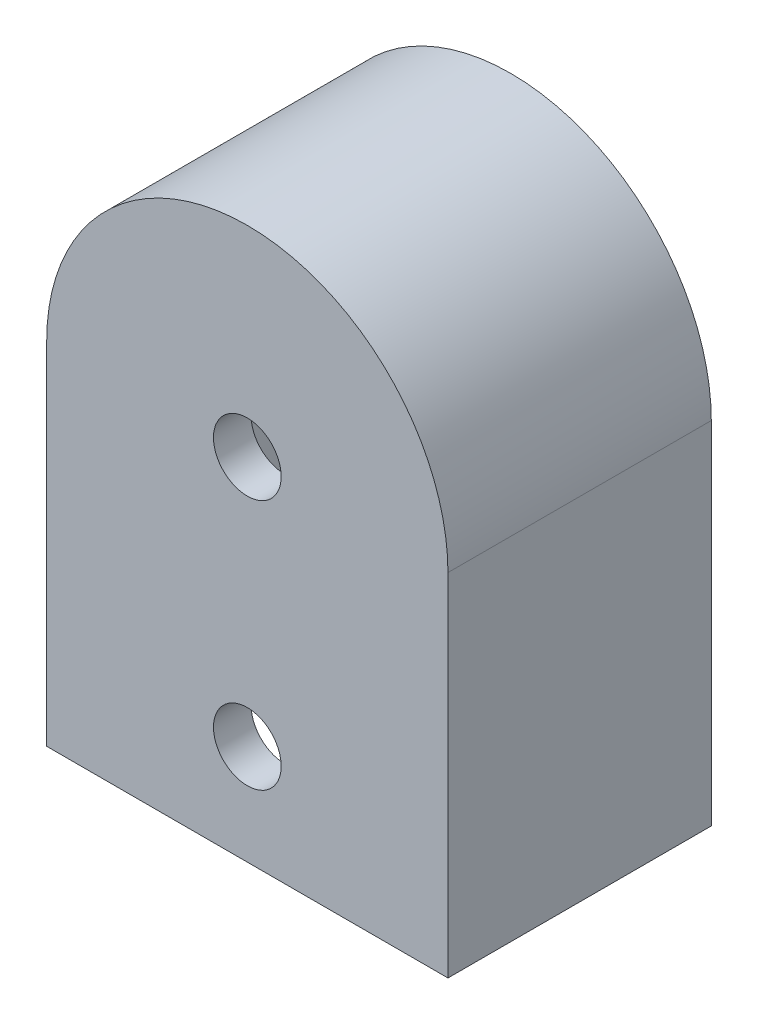
from build123d import *

# Parameters (mm, degrees)
BOSS_EXTRUDE1_DEPTH      = 26.67
SKETCH3_W                = 40.639965772
SKETCH3_H                = 26.67
BOSS_EXTRUDE2_DEPTH      = 35.56
CUT_EXTRUDE3_START       = 3.81
CUT_EXTRUDE3_DEPTH       = 19.05
SKETCH9_W                = 30.48
SKETCH9_H                = 19.05
CUT_EXTRUDE4_DEPTH       = 35.533627808
CUT_EXTRUDE8_REACH       = 50.855
SKETCH10_R               = 3.429
SKETCH11_R               = 5.715
CUT_EXTRUDE9_DEPTH       = 3.048
SKETCH12_R               = 5.715
CUT_EXTRUDE10_DEPTH      = 3.048
SKETCH13_R               = 5.715
CUT_EXTRUDE11_DEPTH      = 3.048
CUT_EXTRUDE12_DEPTH      = 49.855187132
CUT_EXTRUDE12_DEPTH_BACK = 49.855187132
SKETCH16_R               = 3.429


with BuildPart() as part:
    # Sketch2 → Boss-Extrude1 (new body)
    with BuildSketch(Plane.XY):
        with BuildLine():
            Line((-20.319982886, 0.026372192), (20.319982886, 0.026372192))
            ThreePointArc((20.319982886, 0.026372192), (0, 20.32), (-20.319982886, 0.026372192))
        make_face()
    extrude(amount=BOSS_EXTRUDE1_DEPTH)

    # Sketch3 → Boss-Extrude2 (add)
    with BuildSketch(Plane(origin=(0, 0.026372192, 0), x_dir=(-1, 0, 0), z_dir=(0, -1, 0))):
        with Locations((0, -13.335)):
            Rectangle(SKETCH3_W, SKETCH3_H)
    extrude(amount=BOSS_EXTRUDE2_DEPTH)

    # Sketch8 → Cut-Extrude3 (cut)
    with BuildSketch(Plane.XY.offset(CUT_EXTRUDE3_START)):
        with BuildLine():
            Line((15.24, 0), (-15.24, 0))
            ThreePointArc((-15.24, 0), (0, 15.24), (15.24, 0))
        make_face()
    extrude(amount=CUT_EXTRUDE3_DEPTH, mode=Mode.SUBTRACT)

    # Sketch9 → Cut-Extrude4 (cut)
    with BuildSketch(Plane(origin=(0, 0, 0), x_dir=(1, 0, 0), z_dir=(0, 1, 0))):
        with Locations((0, -13.335)):
            Rectangle(SKETCH9_W, SKETCH9_H)
    extrude(amount=-CUT_EXTRUDE4_DEPTH, mode=Mode.SUBTRACT)

    # Cut-Extrude8: up to this face of the body (flat: up to its plane)
    cut_extrude8_end = Plane(part.part.faces().sort_by_distance((0, -9.587434333, 26.67))[0])
    # Sketch10 → Cut-Extrude8 (cut, up to the picked face)
    with BuildSketch(Plane.XY, mode=Mode.PRIVATE) as cut_extrude8_sk1:
        with Locations(Location((0, 0, 0), (0, 0, 180))):
            Circle(SKETCH10_R)
    cut_extrude8_tool1 = split(extrude(cut_extrude8_sk1.sketch, amount=CUT_EXTRUDE8_REACH, mode=Mode.PRIVATE), bisect_by=cut_extrude8_end, keep=Keep.BOTH, mode=Mode.PRIVATE)
    add(cut_extrude8_tool1.solids().sort_by(Axis((0, 0, 0), (0, 0, 1)))[0], mode=Mode.SUBTRACT)

    # Sketch11 → Cut-Extrude9 (cut)
    with BuildSketch(Plane.XY):
        with Locations(Location((12.7, 0, 0), (0, 0, 180))):
            Circle(SKETCH11_R)
    extrude(amount=CUT_EXTRUDE9_DEPTH, mode=Mode.SUBTRACT)

    # Sketch12 → Cut-Extrude10 (cut)
    with BuildSketch(Plane.XY):
        with Locations(Location((12.7, -25.4, 0), (0, 0, 180))):
            Circle(SKETCH12_R)
    extrude(amount=CUT_EXTRUDE10_DEPTH, mode=Mode.SUBTRACT)

    # Sketch13 → Cut-Extrude11 (cut)
    with BuildSketch(Plane(origin=(0, 0, 0), x_dir=(-1, 0, 0), z_dir=(0, 0, -1))):
        with Locations((12.7, 0)):
            Circle(SKETCH13_R)
        with Locations((12.7, -25.4)):
            Circle(SKETCH13_R)
    extrude(amount=-CUT_EXTRUDE11_DEPTH, mode=Mode.SUBTRACT)

    # Sketch16 → Cut-Extrude12 (cut, two sides: drawn at the far end of the back side and taken through both)
    with BuildSketch(Plane(origin=(0, 0, 0), x_dir=(-1, 0, 0), z_dir=(0, 0, -1)).offset(-CUT_EXTRUDE12_DEPTH_BACK)):
        with Locations((0, -25.4)):
            Circle(SKETCH16_R)
    extrude(amount=CUT_EXTRUDE12_DEPTH + CUT_EXTRUDE12_DEPTH_BACK, mode=Mode.SUBTRACT)


solid = part.part
